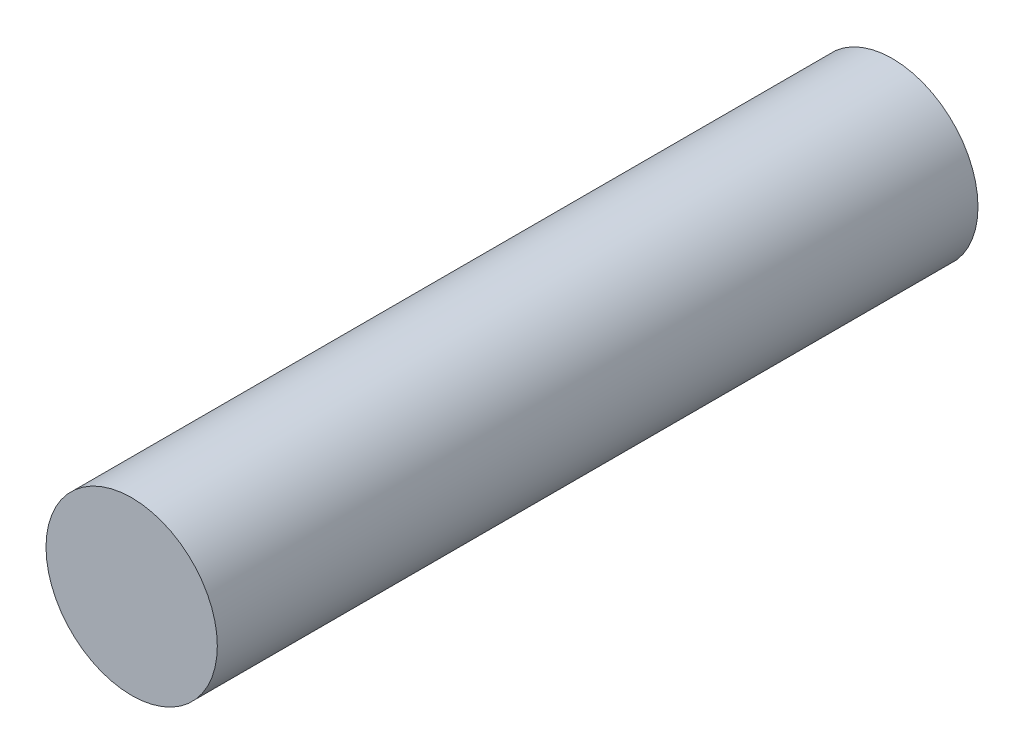
from build123d import *

# Parameters (mm, degrees)
SKETCH1_R           = 0.75
BOSS_EXTRUDE1_DEPTH = 6.66


with BuildPart() as part:
    # Sketch1 → Boss-Extrude1 (new body)
    with BuildSketch(Plane.XY):
        Circle(SKETCH1_R)
    extrude(amount=BOSS_EXTRUDE1_DEPTH)


solid = part.part
